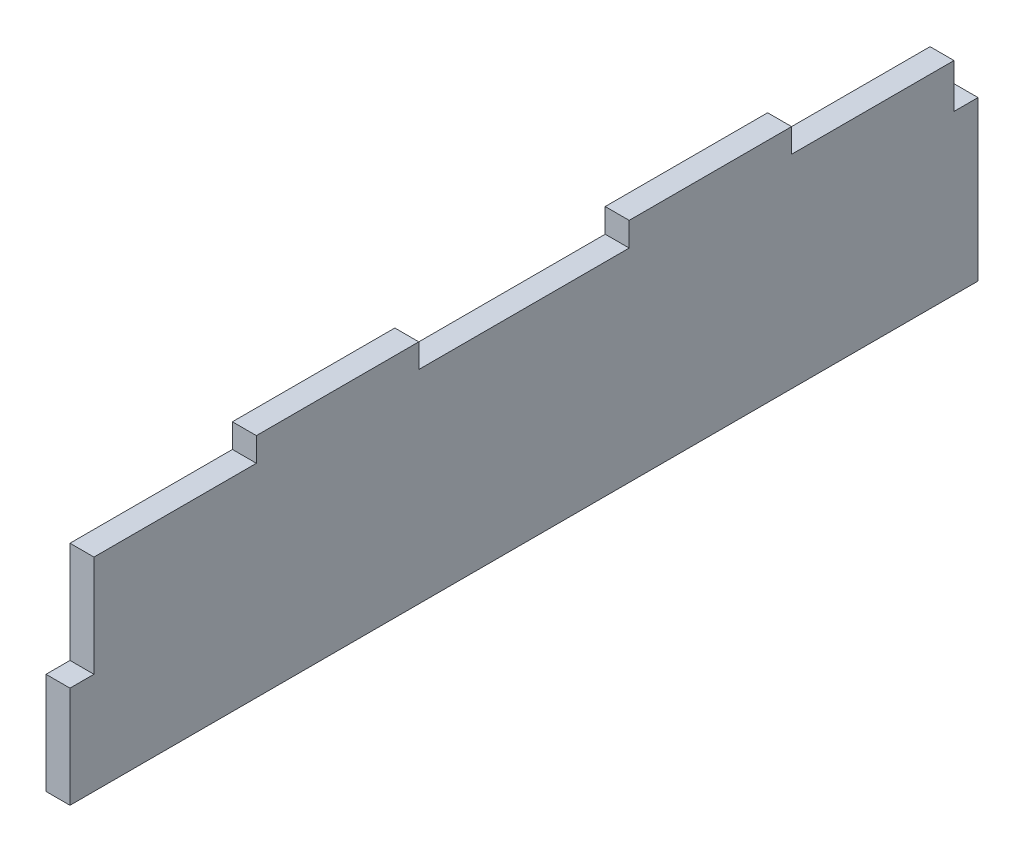
from build123d import *

# Parameters (mm, degrees)
SALIENTE_EXTRUIR1_DEPTH = 3


with BuildPart() as part:
    # Croquis1 → Saliente-Extruir1 (new body)
    with BuildSketch(Plane(origin=(0, 0, 0), x_dir=(0, 0, -1), z_dir=(1, 0, 0))):
        Polygon((0, 0), (0, 12.7), (3, 12.7), (3, 25.4), (23.32, 25.4), (23.32, 28.4), (43.64, 28.4), (43.64, 25.4), (69.96, 25.4), (69.96, 28.4), (90.28, 28.4), (90.28, 25.4), (110.6, 25.4), (110.6, 19.886725664), (113.6, 19.886725664), (113.6, 0), align=None)
    extrude(amount=SALIENTE_EXTRUIR1_DEPTH)


solid = part.part
